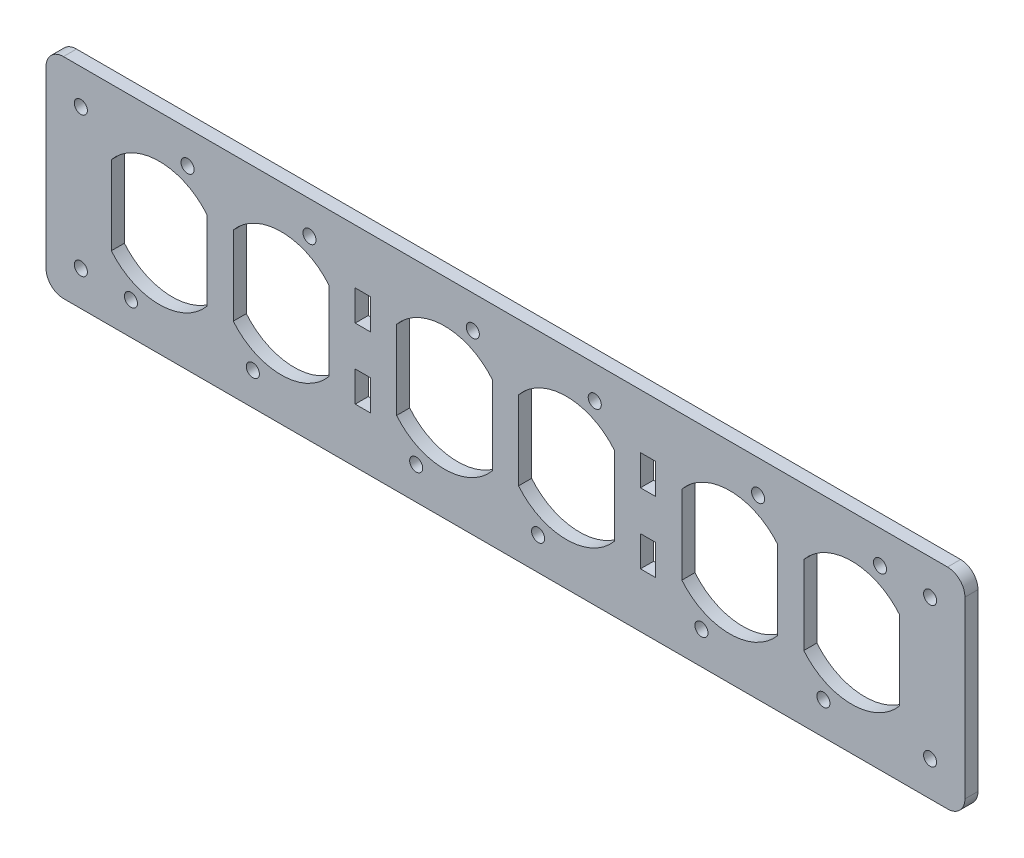
from build123d import *

# Parameters (mm, degrees)
SKETCH1_R           = 1.5
SKETCH1_W           = 3.5
SKETCH1_H           = 7
BOSS_EXTRUDE1_DEPTH = 3


with BuildPart() as part:
    # Sketch1 → Boss-Extrude1 (new body)
    with BuildSketch(Plane.XY):
        with BuildLine():
            Line((4, 0), (207, 0))
            ThreePointArc((207, 0), (209.828427125, 1.171572875), (211, 4))
            Line((211, 4), (211, 44.117670932))
            ThreePointArc((211, 44.117670932), (209.828427125, 46.946098057), (207, 48.117670932))
            Line((207, 48.117670932), (4, 48.117670932))
            ThreePointArc((4, 48.117670932), (1.171572875, 46.946098057), (0, 44.117670932))
            Line((0, 44.117670932), (0, 4))
            ThreePointArc((0, 4), (1.171572875, 1.171572875), (4, 0))
        make_face()
        with Locations((32.5, 40.617670932)):
            Circle(SKETCH1_R, mode=Mode.SUBTRACT)
        with Locations((19.5, 7.5)):
            Circle(SKETCH1_R, mode=Mode.SUBTRACT)
        with Locations((60.5, 40.617670932)):
            Circle(SKETCH1_R, mode=Mode.SUBTRACT)
        with Locations((47.5, 7.5)):
            Circle(SKETCH1_R, mode=Mode.SUBTRACT)
        with Locations((98, 40.617670932)):
            Circle(SKETCH1_R, mode=Mode.SUBTRACT)
        with Locations((85, 7.5)):
            Circle(SKETCH1_R, mode=Mode.SUBTRACT)
        with Locations((126, 40.617670932)):
            Circle(SKETCH1_R, mode=Mode.SUBTRACT)
        with Locations((113, 7.5)):
            Circle(SKETCH1_R, mode=Mode.SUBTRACT)
        with Locations((8, 40.117670932)):
            Circle(SKETCH1_R, mode=Mode.SUBTRACT)
        with Locations((8, 8)):
            Circle(SKETCH1_R, mode=Mode.SUBTRACT)
        with Locations((203, 8)):
            Circle(SKETCH1_R, mode=Mode.SUBTRACT)
        with Locations((203, 40.117670932)):
            Circle(SKETCH1_R, mode=Mode.SUBTRACT)
        with Locations((163.5, 40.617670932)):
            Circle(SKETCH1_R, mode=Mode.SUBTRACT)
        with Locations((150.5, 7.5)):
            Circle(SKETCH1_R, mode=Mode.SUBTRACT)
        with Locations((191.5, 40.617670932)):
            Circle(SKETCH1_R, mode=Mode.SUBTRACT)
        with Locations((178.5, 7.5)):
            Circle(SKETCH1_R, mode=Mode.SUBTRACT)
        with BuildLine():
            Line((15, 15), (15, 33.117670932))
            ThreePointArc((15, 33.117670932), (26, 38.308835466), (37, 33.117670932))
            Line((37, 33.117670932), (37, 15))
            ThreePointArc((37, 15), (26, 9.808835466), (15, 15))
        make_face(mode=Mode.SUBTRACT)
        with BuildLine():
            Line((43, 15), (43, 33.117670932))
            ThreePointArc((43, 33.117670932), (54, 38.308835466), (65, 33.117670932))
            Line((65, 33.117670932), (65, 15))
            ThreePointArc((65, 15), (54, 9.808835466), (43, 15))
        make_face(mode=Mode.SUBTRACT)
        with BuildLine():
            Line((80.5, 15), (80.5, 33.117670932))
            ThreePointArc((80.5, 33.117670932), (91.5, 38.308835466), (102.5, 33.117670932))
            Line((102.5, 33.117670932), (102.5, 15))
            ThreePointArc((102.5, 15), (91.5, 9.808835466), (80.5, 15))
        make_face(mode=Mode.SUBTRACT)
        with Locations((72.75, 32.117670932)):
            Rectangle(SKETCH1_W, SKETCH1_H, mode=Mode.SUBTRACT)
        with Locations((72.75, 16)):
            Rectangle(SKETCH1_W, SKETCH1_H, mode=Mode.SUBTRACT)
        with BuildLine():
            Line((108.5, 15), (108.5, 33.117670932))
            ThreePointArc((108.5, 33.117670932), (119.5, 38.308835466), (130.5, 33.117670932))
            Line((130.5, 33.117670932), (130.5, 15))
            ThreePointArc((130.5, 15), (119.5, 9.808835466), (108.5, 15))
        make_face(mode=Mode.SUBTRACT)
        with BuildLine():
            Line((146, 15), (146, 33.117670932))
            ThreePointArc((146, 33.117670932), (157, 38.308835466), (168, 33.117670932))
            Line((168, 33.117670932), (168, 15))
            ThreePointArc((168, 15), (157, 9.808835466), (146, 15))
        make_face(mode=Mode.SUBTRACT)
        with Locations((138.25, 32.117670932)):
            Rectangle(SKETCH1_W, SKETCH1_H, mode=Mode.SUBTRACT)
        with Locations((138.25, 16)):
            Rectangle(SKETCH1_W, SKETCH1_H, mode=Mode.SUBTRACT)
        with BuildLine():
            Line((174, 15), (174, 33.117670932))
            ThreePointArc((174, 33.117670932), (185, 38.308835466), (196, 33.117670932))
            Line((196, 33.117670932), (196, 15))
            ThreePointArc((196, 15), (185, 9.808835466), (174, 15))
        make_face(mode=Mode.SUBTRACT)
    extrude(amount=BOSS_EXTRUDE1_DEPTH)


solid = part.part
